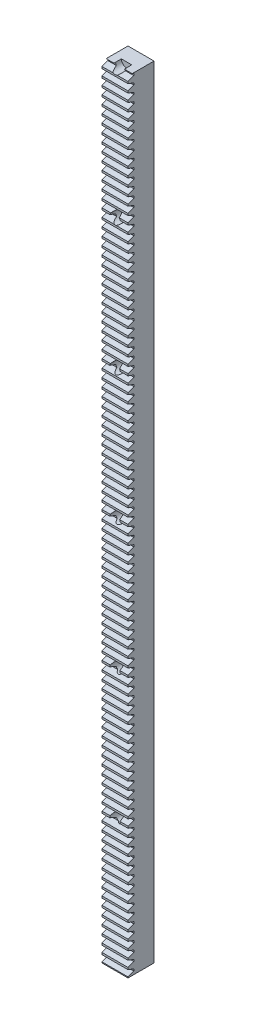
from build123d import *

# Parameters (mm, degrees)
SKETCH_3_W             = 20
SKETCH_3_H             = 20
EXTRUDE_1_DEPTH        = 600
CUT_EXTRUDE_1_REACH    = 602.666
PATTERN_LINEAR_1_COUNT = 96
PATTERN_LINEAR_1_PITCH = 6.27
SKETCH_5_R             = 4
CUT_EXTRUDE_2_DEPTH    = 20
SKETCH_6_R             = 2
CUT_EXTRUDE_3_DEPTH    = 601.666296707
SKETCH_7_R             = 4
CUT_EXTRUDE_4_DEPTH    = 8.9


with BuildPart() as part:
    # 草图3 → 凸台-拉伸1 (new body)
    with BuildSketch(Plane(origin=(0, 0, 0), x_dir=(1, 0, 0), z_dir=(0, 1, 0))):
        with Locations((10, 10)):
            Rectangle(SKETCH_3_W, SKETCH_3_H)
    extrude(amount=EXTRUDE_1_DEPTH)

    # 草图4 → 切除-拉伸1 (cut, up to next)
    with BuildSketch(Plane(origin=(0, 0, 0), x_dir=(0, 0, -1), z_dir=(1, 0, 0)), mode=Mode.PRIVATE) as cut_extrude_1_sk1:
        Polygon((0, 0), (0, 0.748566973), (4.5, 2.386433027), (4.5, 3.883566973), (0, 5.521433027), (0, 6.27), (-2, 6.27), (-2, 0), align=None)
    cut_extrude_1_tool1 = extrude(cut_extrude_1_sk1.sketch, amount=CUT_EXTRUDE_1_REACH, mode=Mode.PRIVATE) & part.part
    cut_extrude_1 = cut_extrude_1_tool1.solids().sort_by_distance((0, 3.135, -0.513147))[0]
    add(cut_extrude_1, mode=Mode.SUBTRACT)

    # 阵列(线性)1: 切除-拉伸1 ×96
    with Locations(*[(0, i * PATTERN_LINEAR_1_PITCH, 0) for i in range(1, PATTERN_LINEAR_1_COUNT)]):
        add(cut_extrude_1, mode=Mode.SUBTRACT)

    # 草图5 → 切除-拉伸2 (cut)
    with BuildSketch(Plane(origin=(0, 0, 0), x_dir=(1, 0, 0), z_dir=(0, 1, 0))):
        with Locations(Location((10, 10, 0), (0, 0, 270))):
            Circle(SKETCH_5_R)
    extrude(amount=CUT_EXTRUDE_2_DEPTH, mode=Mode.SUBTRACT)

    # 草图6 → 切除-拉伸3 (cut, through all)
    with BuildSketch(Plane.XY):
        with Locations((10, 100)):
            Circle(SKETCH_6_R)
        with Locations((10, 200)):
            Circle(SKETCH_6_R)
        with Locations((10, 300)):
            Circle(SKETCH_6_R)
        with Locations((10, 400)):
            Circle(SKETCH_6_R)
        with Locations((10, 500)):
            Circle(SKETCH_6_R)
    extrude(amount=-CUT_EXTRUDE_3_DEPTH, mode=Mode.SUBTRACT)

    # 草图7 → 切除-拉伸4 (cut)
    with BuildSketch(Plane.XY):
        with Locations((10, 100)):
            Circle(SKETCH_7_R)
        with Locations((10, 200)):
            Circle(SKETCH_7_R)
        with Locations((10, 300)):
            Circle(SKETCH_7_R)
        with Locations((10, 400)):
            Circle(SKETCH_7_R)
        with Locations((10, 500)):
            Circle(SKETCH_7_R)
        with Locations((10, 600)):
            Circle(SKETCH_7_R)
    extrude(amount=-CUT_EXTRUDE_4_DEPTH, mode=Mode.SUBTRACT)


solid = part.part
